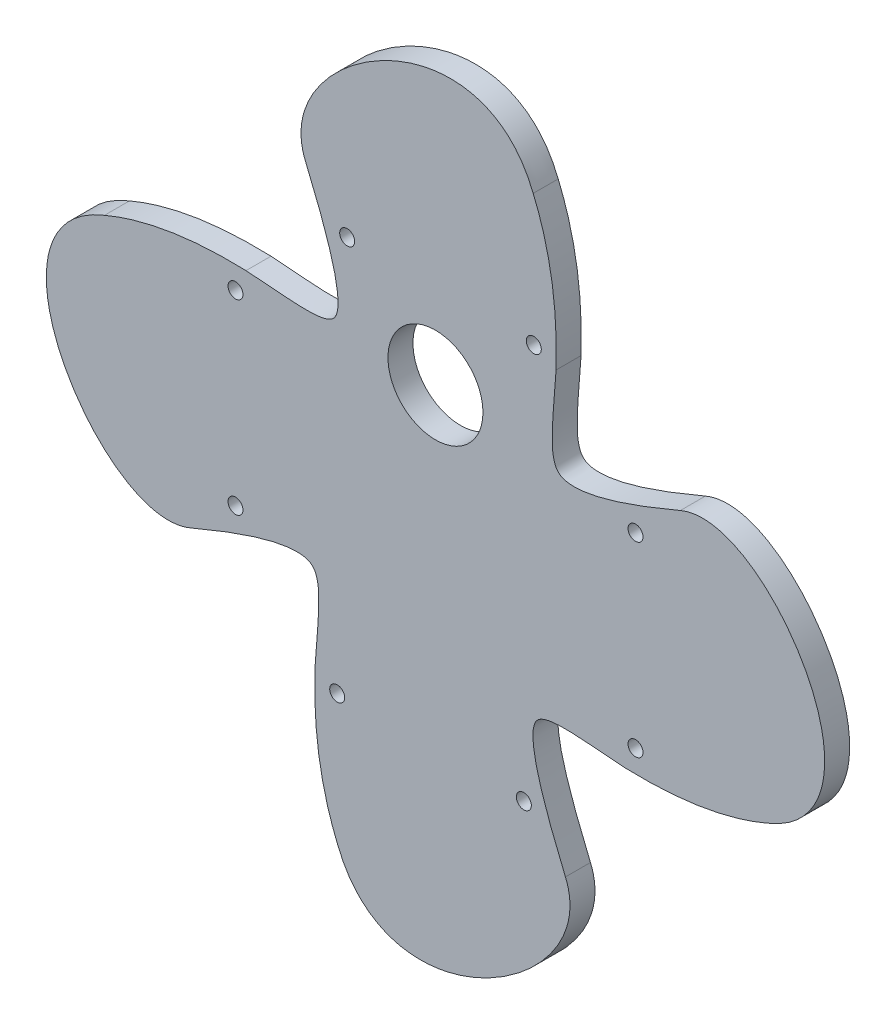
from build123d import *

# Parameters (mm, degrees)
SKETCH1_R           = 9.5
BOSS_EXTRUDE1_DEPTH = 5
CUT_EXTRUDE1_REACH  = 168.202
SKETCH2_R           = 1.5


with BuildPart() as part:
    # Sketch1 → Boss-Extrude1 (new body)
    with BuildSketch(Plane.XY):
        with BuildLine():
            add(Edge.make_bspline(
                [(-3.541993631, -6.941220914), (-8.666968693, 5.104457964), (-8.115333257, 21.36652323)],
                knots=[0.001185094, 0.001185094, 0.001185094, 1.00088873, 1.00088873, 1.00088873], degree=2))
            add(Edge.make_bspline(
                [(-8.115333257, 21.36652323), (-8.080810315, 21.934786101), (-8.004120201, 23.085051659), (-7.838367146, 25.270998375), (-7.623235007, 27.854676625), (-7.414209946, 30.663838605), (-7.27340889, 33.980921817), (-7.462615956, 36.562976188), (-8.030022014, 38.161534692), (-8.552643779, 38.88333972), (-9.230781404, 39.372633244), (-10.414588865, 39.743554777), (-12.295748423, 39.832283225), (-14.89121535, 39.517347468), (-18.210216925, 38.741825063), (-21.599668946, 37.685342297), (-24.705628487, 36.582022017), (-27.236458553, 35.623490455), (-29.523814214, 34.710976102), (-31.451453068, 33.916688086), (-32.46952097, 33.488950312), (-32.970755281, 33.276491829)],
                knots=[6.7148e-05, 6.7148e-05, 6.7148e-05, 6.7148e-05, 0.031331216, 0.062595285, 0.125123423, 0.18765156, 0.250179698, 0.375235973, 0.437764111, 0.500292249, 0.562820386, 0.625348524, 0.687876661, 0.750404799, 0.812932937, 0.875461074, 0.906725143, 0.937989212, 0.969253281, 0.984885315, 1.00051735, 1.00051735, 1.00051735, 1.00051735], degree=3))
            add(Edge.make_bspline(
                [(-32.970755281, 33.276491829), (-33.543064712, 33.029267055), (-34.740218127, 32.630823037), (-37.170579589, 32.259967863), (-40.245026787, 32.517638811), (-43.829157608, 33.765614788), (-48.409124941, 36.43874912), (-53.65340763, 41.342650282), (-58.669628718, 48.874966672), (-61.24629117, 55.881625221), (-61.95764024, 61.562283019), (-61.693372768, 65.766463349), (-60.493626247, 69.792712762), (-58.610027435, 72.848927648), (-56.548030746, 75.0100654), (-54.72673098, 76.467485205), (-52.976799268, 77.533817668), (-51.446162247, 78.288793909), (-50.621789289, 78.638833511), (-50.210214326, 78.800731545)],
                knots=[0.000130926, 0.000130926, 0.000130926, 0.000130926, 0.031365398, 0.06259987, 0.125068815, 0.18753776, 0.250006704, 0.374944594, 0.499882483, 0.624820372, 0.687289317, 0.749758262, 0.812227207, 0.874696151, 0.905930624, 0.937165096, 0.968399568, 0.984016804, 0.999634041, 0.999634041, 0.999634041, 0.999634041], degree=3))
            add(Edge.make_bspline(
                [(-50.210214326, 78.800731545), (-38.164535448, 83.925706607), (-21.902470182, 83.374071171)],
                knots=[0.001185094, 0.001185094, 0.001185094, 1.00088873, 1.00088873, 1.00088873], degree=2))
            add(Edge.make_bspline(
                [(-21.902470182, 83.374071171), (-21.334207311, 83.339548229), (-20.183941753, 83.262858115), (-17.997995037, 83.09710506), (-15.414316787, 82.88197292), (-12.605154807, 82.67294786), (-9.288071595, 82.532146803), (-6.706017224, 82.721353869), (-5.10745872, 83.288759927), (-4.385653692, 83.811381693), (-3.896360168, 84.489519318), (-3.525438635, 85.673326779), (-3.436710187, 87.554486337), (-3.751645944, 90.149953264), (-4.527168349, 93.468954838), (-5.583651115, 96.858406859), (-6.686971395, 99.964366401), (-7.645502957, 102.495196467), (-8.55801731, 104.782552127), (-9.352305325, 106.710190982), (-9.7800431, 107.728258884), (-9.992501583, 108.229493195)],
                knots=[6.7148e-05, 6.7148e-05, 6.7148e-05, 6.7148e-05, 0.031331216, 0.062595285, 0.125123423, 0.18765156, 0.250179698, 0.375235973, 0.437764111, 0.500292249, 0.562820386, 0.625348524, 0.687876661, 0.750404799, 0.812932937, 0.875461074, 0.906725143, 0.937989212, 0.969253281, 0.984885315, 1.00051735, 1.00051735, 1.00051735, 1.00051735], degree=3))
            add(Edge.make_bspline(
                [(-9.992501583, 108.229493195), (-10.239726357, 108.801802626), (-10.638170375, 109.998956041), (-11.009025549, 112.429317503), (-10.751354601, 115.503764701), (-9.503378624, 119.087895522), (-6.830244292, 123.667862855), (-1.92634313, 128.912145544), (5.60597326, 133.928366631), (12.612631809, 136.505029084), (18.293289607, 137.216378153), (22.497469937, 136.952110682), (26.52371935, 135.752364161), (29.579934236, 133.868765349), (31.741071988, 131.806768659), (33.198491794, 129.985468894), (34.264824256, 128.235537182), (35.019800497, 126.704900161), (35.369840099, 125.880527203), (35.531738133, 125.468952239)],
                knots=[0.000130926, 0.000130926, 0.000130926, 0.000130926, 0.031365398, 0.06259987, 0.125068815, 0.18753776, 0.250006704, 0.374944594, 0.499882483, 0.624820372, 0.687289317, 0.749758262, 0.812227207, 0.874696151, 0.905930624, 0.937165096, 0.968399568, 0.984016804, 0.999634041, 0.999634041, 0.999634041, 0.999634041], degree=3))
            add(Edge.make_bspline(
                [(35.531738133, 125.468952239), (40.656713195, 113.423273362), (40.105077759, 97.161208095)],
                knots=[0.001185094, 0.001185094, 0.001185094, 1.00088873, 1.00088873, 1.00088873], degree=2))
            add(Edge.make_bspline(
                [(40.105077759, 97.161208095), (40.070554817, 96.592945225), (39.993864703, 95.442679666), (39.828111648, 93.256732951), (39.612979508, 90.6730547), (39.403954448, 87.863892721), (39.263153391, 84.546809509), (39.452360457, 81.964755138), (40.019766515, 80.366196634), (40.542388281, 79.644391606), (41.220525906, 79.155098082), (42.404333367, 78.784176549), (44.285492925, 78.695448101), (46.880959852, 79.010383858), (50.199961426, 79.785906263), (53.589413447, 80.842389028), (56.695372989, 81.945709309), (59.226203055, 82.90424087), (61.513558715, 83.816755223), (63.44119757, 84.611043239), (64.459265472, 85.038781014), (64.960499783, 85.251239496)],
                knots=[6.7148e-05, 6.7148e-05, 6.7148e-05, 6.7148e-05, 0.031331216, 0.062595285, 0.125123423, 0.18765156, 0.250179698, 0.375235973, 0.437764111, 0.500292249, 0.562820386, 0.625348524, 0.687876661, 0.750404799, 0.812932937, 0.875461074, 0.906725143, 0.937989212, 0.969253281, 0.984885315, 1.00051735, 1.00051735, 1.00051735, 1.00051735], degree=3))
            add(Edge.make_bspline(
                [(64.960499783, 85.251239496), (65.532809214, 85.49846427), (66.729962629, 85.896908288), (69.160324091, 86.267763462), (72.234771289, 86.010092514), (75.81890211, 84.762116538), (80.398869443, 82.088982206), (85.643152132, 77.185081044), (90.65937322, 69.652764653), (93.236035672, 62.646106105), (93.947384741, 56.965448307), (93.68311727, 52.761267977), (92.483370749, 48.735018564), (90.599771937, 45.678803677), (88.537775247, 43.517665925), (86.716475482, 42.06024612), (84.96654377, 40.993913657), (83.435906749, 40.238937417), (82.611533791, 39.888897814), (82.199958827, 39.726999781)],
                knots=[0.000130926, 0.000130926, 0.000130926, 0.000130926, 0.031365398, 0.06259987, 0.125068815, 0.18753776, 0.250006704, 0.374944594, 0.499882483, 0.624820372, 0.687289317, 0.749758262, 0.812227207, 0.874696151, 0.905930624, 0.937165096, 0.968399568, 0.984016804, 0.999634041, 0.999634041, 0.999634041, 0.999634041], degree=3))
            add(Edge.make_bspline(
                [(82.199958827, 39.726999781), (70.15427995, 34.602024719), (53.892214683, 35.153660155)],
                knots=[0.001185094, 0.001185094, 0.001185094, 1.00088873, 1.00088873, 1.00088873], degree=2))
            add(Edge.make_bspline(
                [(53.892214683, 35.153660155), (53.323951813, 35.188183097), (52.173686254, 35.26487321), (49.987739539, 35.430626266), (47.404061288, 35.645758405), (44.594899309, 35.854783466), (41.277816097, 35.995584522), (38.695761726, 35.806377456), (37.097203222, 35.238971398), (36.375398194, 34.716349633), (35.88610467, 34.038212008), (35.515183137, 32.854404547), (35.426454689, 30.973244989), (35.741390446, 28.377778061), (36.516912851, 25.058776487), (37.573395616, 21.669324466), (38.676715897, 18.563364925), (39.635247458, 16.032534859), (40.547761811, 13.745179198), (41.342049827, 11.817540344), (41.769787602, 10.799472441), (41.982246084, 10.298238131)],
                knots=[6.7148e-05, 6.7148e-05, 6.7148e-05, 6.7148e-05, 0.031331216, 0.062595285, 0.125123423, 0.18765156, 0.250179698, 0.375235973, 0.437764111, 0.500292249, 0.562820386, 0.625348524, 0.687876661, 0.750404799, 0.812932937, 0.875461074, 0.906725143, 0.937989212, 0.969253281, 0.984885315, 1.00051735, 1.00051735, 1.00051735, 1.00051735], degree=3))
            add(Edge.make_bspline(
                [(41.982246084, 10.298238131), (42.229470859, 9.7259287), (42.627914876, 8.528775285), (42.99877005, 6.098413823), (42.741099102, 3.023966625), (41.493123126, -0.560164196), (38.819988794, -5.140131529), (33.916087632, -10.384414218), (26.383771241, -15.400635306), (19.377112693, -17.977297758), (13.696454895, -18.688646828), (9.492274565, -18.424379356), (5.466025152, -17.224632835), (2.409810265, -15.341034023), (0.248672513, -13.279037334), (-1.208747292, -11.457737569), (-2.275079754, -9.707805856), (-3.030055995, -8.177168835), (-3.380095598, -7.352795877), (-3.541993631, -6.941220914)],
                knots=[0.000130926, 0.000130926, 0.000130926, 0.000130926, 0.031365398, 0.06259987, 0.125068815, 0.18753776, 0.250006704, 0.374944594, 0.499882483, 0.624820372, 0.687289317, 0.749758262, 0.812227207, 0.874696151, 0.905930624, 0.937165096, 0.968399568, 0.984016804, 0.999634041, 0.999634041, 0.999634041, 0.999634041], degree=3))
        make_face()
        with Locations((15.985900406, 82.503927946)):
            Circle(SKETCH1_R, mode=Mode.SUBTRACT)
    extrude(amount=BOSS_EXTRUDE1_DEPTH)

    # Sketch2 → Cut-Extrude1 (cut, up to next)
    with BuildSketch(Plane.XY.offset(5), mode=Mode.PRIVATE) as cut_extrude1_sk1:
        with Locations((-1.671081209, 99.263865663)):
            Circle(SKETCH2_R)
    cut_extrude1_tool1 = extrude(cut_extrude1_sk1.sketch, amount=-CUT_EXTRUDE1_REACH, mode=Mode.PRIVATE) & part.part
    # Sketch2 → Cut-Extrude1 (cut, up to next)
    with BuildSketch(Plane.XY.offset(5), mode=Mode.PRIVATE) as cut_extrude1_sk2:
        with Locations((35.652879616, 99.263865663)):
            Circle(SKETCH2_R)
    cut_extrude1_tool2 = extrude(cut_extrude1_sk2.sketch, amount=-CUT_EXTRUDE1_REACH, mode=Mode.PRIVATE) & part.part
    # Sketch2 → Cut-Extrude1 (cut, up to next)
    with BuildSketch(Plane.XY.offset(5), mode=Mode.PRIVATE) as cut_extrude1_sk3:
        with Locations((55.994872251, 39.605858298)):
            Circle(SKETCH2_R)
    cut_extrude1_tool3 = extrude(cut_extrude1_sk3.sketch, amount=-CUT_EXTRUDE1_REACH, mode=Mode.PRIVATE) & part.part
    # Sketch2 → Cut-Extrude1 (cut, up to next)
    with BuildSketch(Plane.XY.offset(5), mode=Mode.PRIVATE) as cut_extrude1_sk4:
        with Locations((55.994872251, 76.929819123)):
            Circle(SKETCH2_R)
    cut_extrude1_tool4 = extrude(cut_extrude1_sk4.sketch, amount=-CUT_EXTRUDE1_REACH, mode=Mode.PRIVATE) & part.part
    # Sketch2 → Cut-Extrude1 (cut, up to next)
    with BuildSketch(Plane.XY.offset(5), mode=Mode.PRIVATE) as cut_extrude1_sk5:
        with Locations((-3.663135114, 19.263865663)):
            Circle(SKETCH2_R)
    cut_extrude1_tool5 = extrude(cut_extrude1_sk5.sketch, amount=-CUT_EXTRUDE1_REACH, mode=Mode.PRIVATE) & part.part
    # Sketch2 → Cut-Extrude1 (cut, up to next)
    with BuildSketch(Plane.XY.offset(5), mode=Mode.PRIVATE) as cut_extrude1_sk6:
        with Locations((33.660825711, 19.263865663)):
            Circle(SKETCH2_R)
    cut_extrude1_tool6 = extrude(cut_extrude1_sk6.sketch, amount=-CUT_EXTRUDE1_REACH, mode=Mode.PRIVATE) & part.part
    # Sketch2 → Cut-Extrude1 (cut, up to next)
    with BuildSketch(Plane.XY.offset(5), mode=Mode.PRIVATE) as cut_extrude1_sk7:
        with Locations((-24.005127749, 78.921873027)):
            Circle(SKETCH2_R)
    cut_extrude1_tool7 = extrude(cut_extrude1_sk7.sketch, amount=-CUT_EXTRUDE1_REACH, mode=Mode.PRIVATE) & part.part
    # Sketch2 → Cut-Extrude1 (cut, up to next)
    with BuildSketch(Plane.XY.offset(5), mode=Mode.PRIVATE) as cut_extrude1_sk8:
        with Locations((-24.005127749, 41.597912203)):
            Circle(SKETCH2_R)
    cut_extrude1_tool8 = extrude(cut_extrude1_sk8.sketch, amount=-CUT_EXTRUDE1_REACH, mode=Mode.PRIVATE) & part.part
    add(cut_extrude1_tool1.solids().sort_by_distance((-1.671081, 99.263866, 5))[0], mode=Mode.SUBTRACT)
    add(cut_extrude1_tool2.solids().sort_by_distance((35.65288, 99.263866, 5))[0], mode=Mode.SUBTRACT)
    add(cut_extrude1_tool3.solids().sort_by_distance((55.994872, 39.605858, 5))[0], mode=Mode.SUBTRACT)
    add(cut_extrude1_tool4.solids().sort_by_distance((55.994872, 76.929819, 5))[0], mode=Mode.SUBTRACT)
    add(cut_extrude1_tool5.solids().sort_by_distance((-3.663135, 19.263866, 5))[0], mode=Mode.SUBTRACT)
    add(cut_extrude1_tool6.solids().sort_by_distance((33.660826, 19.263866, 5))[0], mode=Mode.SUBTRACT)
    add(cut_extrude1_tool7.solids().sort_by_distance((-24.005128, 78.921873, 5))[0], mode=Mode.SUBTRACT)
    add(cut_extrude1_tool8.solids().sort_by_distance((-24.005128, 41.597912, 5))[0], mode=Mode.SUBTRACT)


solid = part.part
